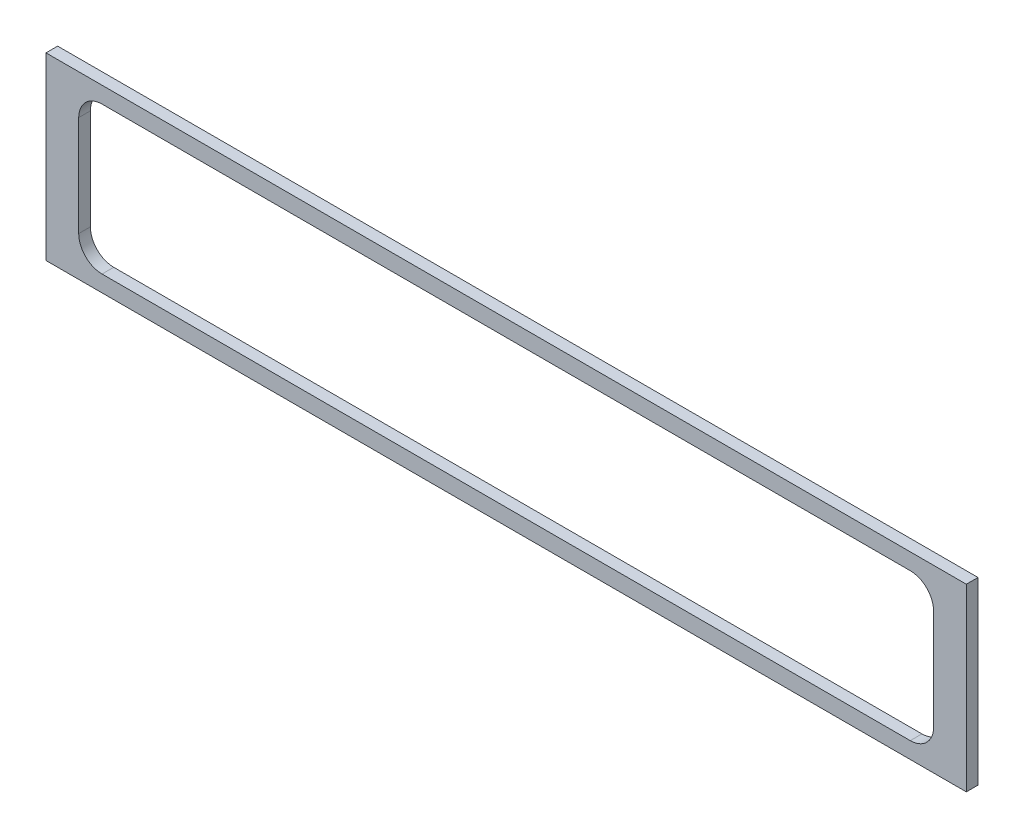
from build123d import *

# Parameters (mm, degrees)
SZKIC1_W                    = 394
SZKIC1_H                    = 77
DODANIE_WYCI_GNI_CIE1_DEPTH = 5
WYTNIJ_WYCI_GNI_CIE1_DEPTH  = 10


with BuildPart() as part:
    # Szkic1 → Dodanie-wyciągnięcie1 (new body)
    with BuildSketch(Plane.XY):
        with Locations((-82.604690639, -71.272983114)):
            Rectangle(SZKIC1_W, SZKIC1_H)
    extrude(amount=DODANIE_WYCI_GNI_CIE1_DEPTH)

    # Szkic2 → Wytnij-wyciągnięcie1 (cut)
    with BuildSketch(Plane.XY.offset(5)):
        with BuildLine():
            Line((-255.604690639, -39.772983114), (90.395309361, -39.772983114))
            ThreePointArc((90.395309361, -39.772983114), (97.466377173, -42.701915303), (100.395309361, -49.772983114))
            Line((100.395309361, -49.772983114), (100.395309361, -92.772983114))
            ThreePointArc((100.395309361, -92.772983114), (97.466377173, -99.844050926), (90.395309361, -102.772983114))
            Line((90.395309361, -102.772983114), (-255.604690639, -102.772983114))
            ThreePointArc((-255.604690639, -102.772983114), (-262.675758451, -99.844050926), (-265.604690639, -92.772983114))
            Line((-265.604690639, -92.772983114), (-265.604690639, -49.772983114))
            ThreePointArc((-265.604690639, -49.772983114), (-262.675758451, -42.701915303), (-255.604690639, -39.772983114))
        make_face()
    extrude(amount=-WYTNIJ_WYCI_GNI_CIE1_DEPTH, mode=Mode.SUBTRACT)


solid = part.part
